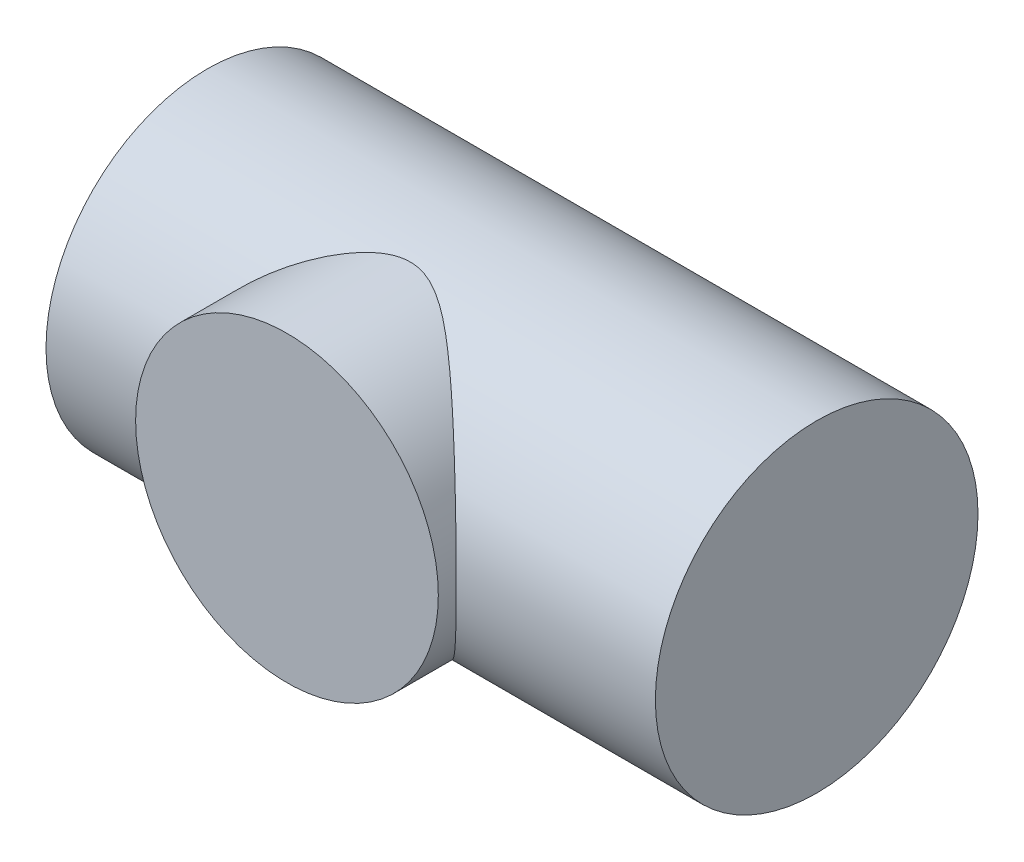
from build123d import *

# Parameters (mm, degrees)
BOSS_EXTRUDE1_START = -0.065
SKETCH1_R           = 0.0405
BOSS_EXTRUDE1_DEPTH = 0.153
SKETCH2_R           = 0.038
BOSS_EXTRUDE2_DEPTH = 0.045


with BuildPart() as part:
    # Sketch1 → Boss-Extrude1 (new body)
    with BuildSketch(Plane(origin=(0, 0, 0), x_dir=(0, 0, -1), z_dir=(1, 0, 0)).offset(BOSS_EXTRUDE1_START)):
        Circle(SKETCH1_R)
    extrude(amount=BOSS_EXTRUDE1_DEPTH)

    # Sketch2 → Boss-Extrude2 (add)
    with BuildSketch(Plane.XY):
        Circle(SKETCH2_R)
    extrude(amount=BOSS_EXTRUDE2_DEPTH)


solid = part.part
